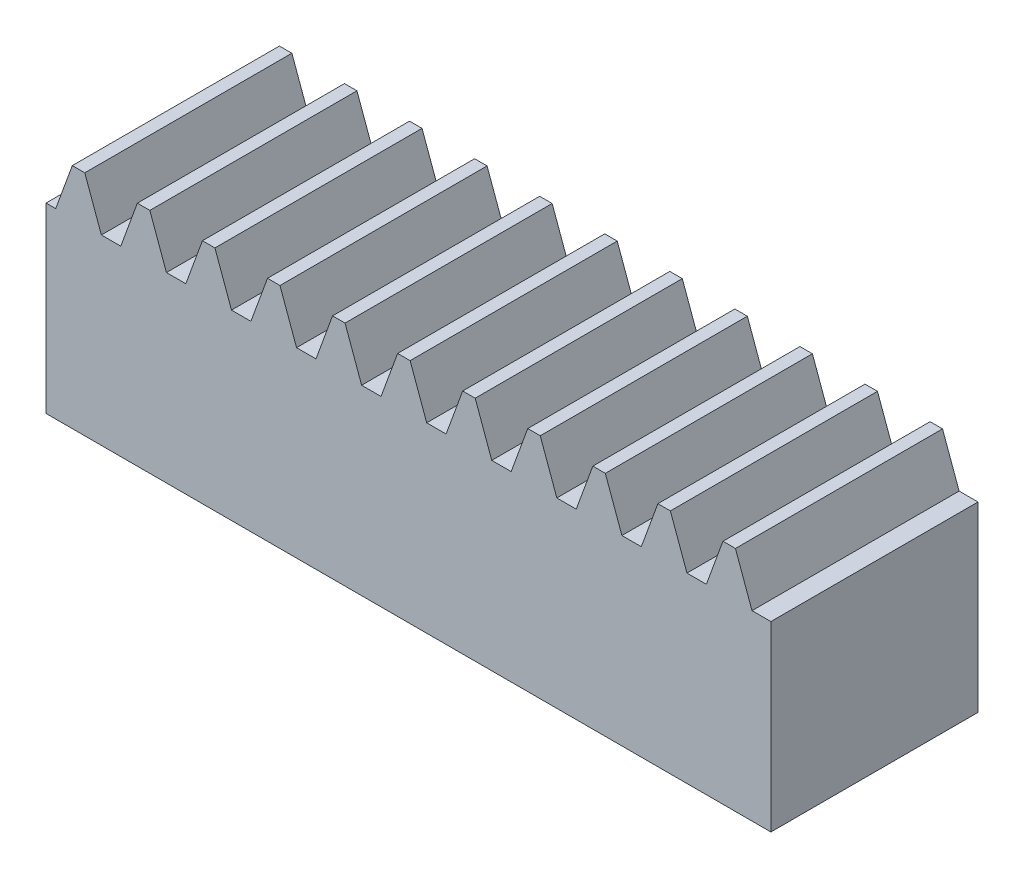
from build123d import *

# Parameters (mm, degrees)
BLANKSKE_W        = 44.45
BLANKSKE_H        = 13.97
BLANK_DEPTH       = 12.7
TOOTHCUTSIM_DEPTH = 49.293409488
TEETHCUTS_COUNT   = 12
TEETHCUTS_PITCH   = 3.989822665


with BuildPart() as part:
    # BlankSke → Blank (new body)
    with BuildSketch(Plane.XY):
        with Locations((22.225, 6.985)):
            Rectangle(BLANKSKE_W, BLANKSKE_H)
    extrude(amount=-BLANK_DEPTH)

    # TooCutSkeSim → ToothCutSim (cut, through all)
    with BuildSketch(Plane.XY):
        Polygon((0.595165029, 11.176), (-0.595165029, 11.176), (-1.621342708, 13.9954), (1.621342708, 13.9954), align=None)
    toothcutsim = extrude(amount=-TOOTHCUTSIM_DEPTH, mode=Mode.SUBTRACT)

    # TeethCuts: ToothCutSim ×12
    with Locations(*[(i * TEETHCUTS_PITCH, 0, 0) for i in range(1, TEETHCUTS_COUNT)]):
        add(toothcutsim, mode=Mode.SUBTRACT)


solid = part.part
